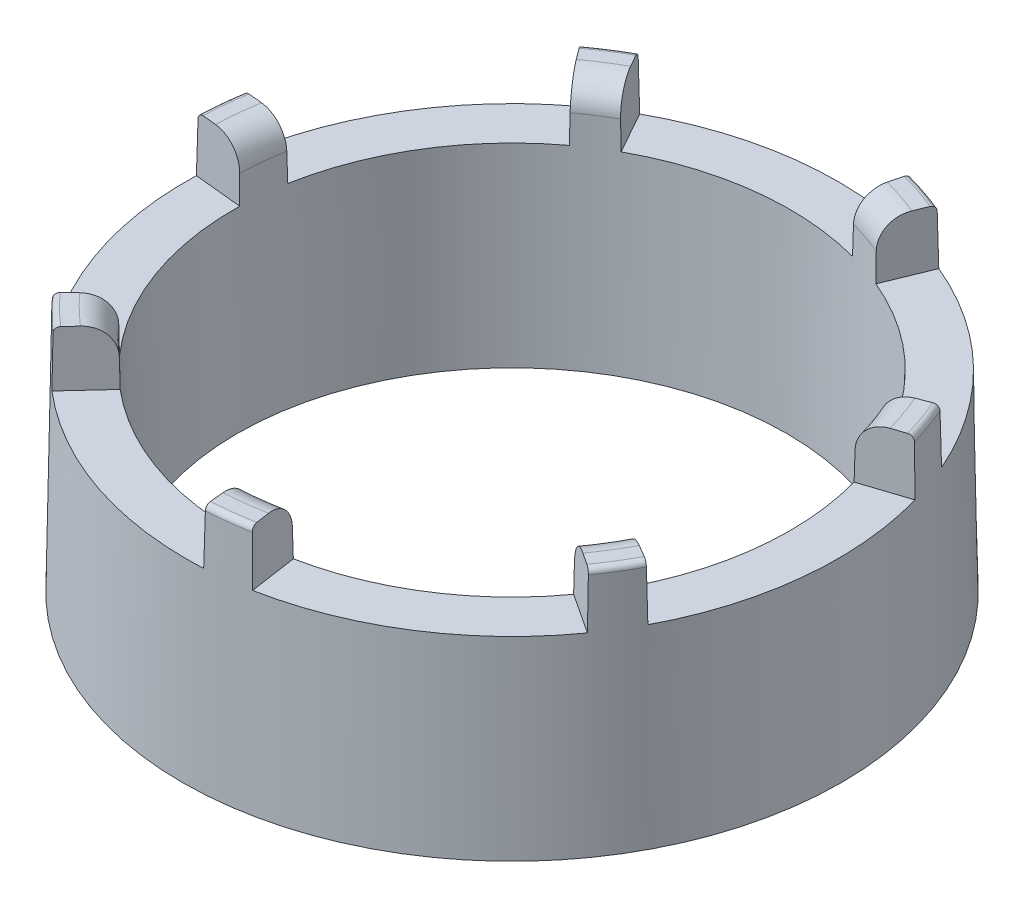
from build123d import *

# Parameters (mm, degrees)
SKETCH8_R                     = 12
SKETCH8_R_2                   = 10
BOSS_EXTRUDE5_DEPTH           = 7
BOSS_EXTRUDE5_DRAFT           = 1
BOSS_EXTRUDE7_DEPTH           = 2
BOSS_EXTRUDE7_DRAFT           = 1
BOSS_EXTRUDE7_PROFILE_2_DEPTH = 2
BOSS_EXTRUDE7_PROFILE_2_DRAFT = 1
BOSS_EXTRUDE7_PROFILE_3_DEPTH = 2
BOSS_EXTRUDE7_PROFILE_3_DRAFT = 1
BOSS_EXTRUDE7_PROFILE_4_DEPTH = 2
BOSS_EXTRUDE7_PROFILE_4_DRAFT = 1
BOSS_EXTRUDE7_PROFILE_5_DEPTH = 2
BOSS_EXTRUDE7_PROFILE_5_DRAFT = 1
BOSS_EXTRUDE7_PROFILE_6_DEPTH = 2
BOSS_EXTRUDE7_PROFILE_6_DRAFT = 1
BOSS_EXTRUDE7_PROFILE_7_DEPTH = 2
BOSS_EXTRUDE7_PROFILE_7_DRAFT = 1
FILLET3_R                     = 0.2
FILLET4_R                     = 1


with BuildPart() as part:
    # Sketch8 → Boss-Extrude5 (with draft: the straight prism first)
    with BuildSketch(Plane(origin=(0, 0, 0), x_dir=(1, 0, 0), z_dir=(0, 1, 0))):
        with Locations((-0.689500998, 0.229833666)):
            Circle(SKETCH8_R)
        with Locations((-0.689500998, 0.229833666)):
            Circle(SKETCH8_R_2, mode=Mode.SUBTRACT)
    extrude(amount=BOSS_EXTRUDE5_DEPTH)
    # Boss-Extrude5: the draft: its side faces are tilted about the plane it starts from
    boss_extrude5_sides = [part.faces().sort_by_distance(p)[0] for p in [
        (-12.689500998, 3.5, -0.229833666),
        (-10.689500998, 3.5, -0.229833666),
    ]]
    draft(boss_extrude5_sides, Plane(origin=(0, 0, 0), x_dir=(1, 0, 0), z_dir=(0, 1, 0)), BOSS_EXTRUDE5_DRAFT)


with BuildPart() as boss_extrude7_tool:
    # Sketch9 → Boss-Extrude7 (with draft: the straight prism first)
    with BuildSketch(Plane(origin=(0, 7, 0), x_dir=(1, 0, 0), z_dir=(0, 1, 0))):
        with BuildLine():
            ThreePointArc((-7.209347937, -7.512919996), (-7.765123044, -7.008550894), (-8.28199938, -6.464388222))
            Line((-8.28199938, -6.464388222), (-9.545268932, -7.685837669))
            ThreePointArc((-9.545268932, -7.685837669), (-8.992344967, -8.264002947), (-8.401756366, -8.803637179))
            Line((-8.401756366, -8.803637179), (-7.209347937, -7.512919996))
        make_face()
    extrude(amount=BOSS_EXTRUDE7_DEPTH)
    # Boss-Extrude7: the draft: its side faces are tilted about the plane it starts from
    boss_extrude7_sides = [boss_extrude7_tool.faces().sort_by_distance(p)[0] for p in [
        (-8.992344967, 8, 8.264002947),
        (-7.805552152, 8, 8.158278588),
        (-7.765123044, 8, 7.008550894),
        (-8.913634156, 8, 7.075112945),
    ]]
    draft(boss_extrude7_sides, Plane(origin=(0, 7, 0), x_dir=(1, 0, 0), z_dir=(0, 1, 0)), BOSS_EXTRUDE7_DRAFT)


with BuildPart() as part_1:
    add(part.part)

    # Boss-Extrude7: add boss_extrude7_tool
    add(boss_extrude7_tool.part)


with BuildPart() as boss_extrude7_profile_2_tool:
    # Sketch9 → Boss-Extrude7 profile 2 (with draft: the straight prism first)
    with BuildSketch(Plane(origin=(0, 7, 0), x_dir=(1, 0, 0), z_dir=(0, 1, 0))):
        with BuildLine():
            ThreePointArc((-10.809530951, 0.438716694), (-10.761410839, 1.237440003), (-10.650350336, 2.029866676))
            Line((-10.650350336, 2.029866676), (-12.401922464, 2.205096122))
            ThreePointArc((-12.401922464, 2.205096122), (-12.508319943, 1.412202953), (-12.56110308, 0.61394614))
            Line((-12.56110308, 0.61394614), (-10.809530951, 0.438716694))
        make_face()
    extrude(amount=BOSS_EXTRUDE7_PROFILE_2_DEPTH)
    # Boss-Extrude7 profile 2: the draft: its side faces are tilted about the plane it starts from
    boss_extrude7_profile_2_sides = [boss_extrude7_profile_2_tool.faces().sort_by_distance(p)[0] for p in [
        (-11.685317015, 8, -0.526331417),
        (-10.761410839, 8, -1.237440003),
        (-11.5261364, 8, -2.117481399),
        (-12.508319943, 8, -1.412202953),
    ]]
    draft(boss_extrude7_profile_2_sides, Plane(origin=(0, 7, 0), x_dir=(1, 0, 0), z_dir=(0, 1, 0)), BOSS_EXTRUDE7_PROFILE_2_DRAFT)


with BuildPart() as part_2:
    add(part_1.part)

    # Boss-Extrude7 profile 2: add boss_extrude7_profile_2_tool
    add(boss_extrude7_profile_2_tool.part)


with BuildPart() as boss_extrude7_profile_3_tool:
    # Sketch9 → Boss-Extrude7 profile 3 (with draft: the straight prism first)
    with BuildSketch(Plane(origin=(0, 7, 0), x_dir=(1, 0, 0), z_dir=(0, 1, 0))):
        with BuildLine():
            ThreePointArc((-6.727066623, 8.354268397), (-6.166482087, 8.742254974), (-5.581052028, 9.091626199))
            Line((-5.581052028, 9.091626199), (-6.436662035, 10.624669806))
            ThreePointArc((-6.436662035, 10.624669806), (-7.123347108, 10.214226618), (-7.78084598, 9.758490692))
            Line((-7.78084598, 9.758490692), (-6.727066623, 8.354268397))
        make_face()
    extrude(amount=BOSS_EXTRUDE7_PROFILE_3_DEPTH)
    # Boss-Extrude7 profile 3: the draft: its side faces are tilted about the plane it starts from
    boss_extrude7_profile_3_sides = [boss_extrude7_profile_3_tool.faces().sort_by_distance(p)[0] for p in [
        (-7.253956301, 8, -9.056379545),
        (-6.166482087, 8, -8.742254974),
        (-6.008857032, 8, -9.858148003),
        (-7.123347108, 8, -10.214226618),
    ]]
    draft(boss_extrude7_profile_3_sides, Plane(origin=(0, 7, 0), x_dir=(1, 0, 0), z_dir=(0, 1, 0)), BOSS_EXTRUDE7_PROFILE_3_DRAFT)


with BuildPart() as part_3:
    add(part_2.part)

    # Boss-Extrude7 profile 3: add boss_extrude7_profile_3_tool
    add(boss_extrude7_profile_3_tool.part)


with BuildPart() as boss_extrude7_profile_4_tool:
    # Sketch9 → Boss-Extrude7 profile 4 (with draft: the straight prism first)
    with BuildSketch(Plane(origin=(0, 7, 0), x_dir=(1, 0, 0), z_dir=(0, 1, 0))):
        with BuildLine():
            Line((2.366640727, 11.7077462), (1.926100917, 10.008241767))
            ThreePointArc((1.926100917, 10.008241767), (2.578394525, 9.809995315), (3.215863804, 9.568289863))
            Line((3.215863804, 9.568289863), (3.880694044, 11.193217982))
            ThreePointArc((3.880694044, 11.193217982), (3.132335987, 11.475990362), (2.366640727, 11.7077462))
        make_face()
    extrude(amount=BOSS_EXTRUDE7_PROFILE_4_DEPTH)
    # Boss-Extrude7 profile 4: the draft: its side faces are tilted about the plane it starts from
    boss_extrude7_profile_4_sides = [boss_extrude7_profile_4_tool.faces().sort_by_distance(p)[0] for p in [
        (3.132335987, 8, -11.475990362),
        (2.146370822, 8, -10.857993984),
        (2.578394525, 8, -9.809995315),
        (3.548278924, 8, -10.380753922),
    ]]
    draft(boss_extrude7_profile_4_sides, Plane(origin=(0, 7, 0), x_dir=(1, 0, 0), z_dir=(0, 1, 0)), BOSS_EXTRUDE7_PROFILE_4_DRAFT)


with BuildPart() as part_4:
    add(part_3.part)

    # Boss-Extrude7 profile 4: add boss_extrude7_profile_4_tool
    add(boss_extrude7_profile_4_tool.part)


with BuildPart() as boss_extrude7_profile_5_tool:
    # Sketch9 → Boss-Extrude7 profile 5 (with draft: the straight prism first)
    with BuildSketch(Plane(origin=(0, 7, 0), x_dir=(1, 0, 0), z_dir=(0, 1, 0))):
        with BuildLine():
            Line((10.198955387, 4.975778875), (8.561854638, 4.337272925))
            ThreePointArc((8.561854638, 4.337272925), (8.840763983, 3.640506293), (9.06727997, 2.92498923))
            Line((9.06727997, 2.92498923), (10.737769949, 3.470197392))
            ThreePointArc((10.737769949, 3.470197392), (10.493728209, 4.232065904), (10.198955387, 4.975778875))
        make_face()
    extrude(amount=BOSS_EXTRUDE7_PROFILE_5_DEPTH)
    # Boss-Extrude7 profile 5: the draft: its side faces are tilted about the plane it starts from
    boss_extrude7_profile_5_sides = [boss_extrude7_profile_5_tool.faces().sort_by_distance(p)[0] for p in [
        (10.493728209, 8, -4.232065904),
        (9.380405013, 8, -4.6565259),
        (8.840763983, 8, -3.640506293),
        (9.90252496, 8, -3.197593311),
    ]]
    draft(boss_extrude7_profile_5_sides, Plane(origin=(0, 7, 0), x_dir=(1, 0, 0), z_dir=(0, 1, 0)), BOSS_EXTRUDE7_PROFILE_5_DRAFT)


with BuildPart() as part_5:
    add(part_4.part)

    # Boss-Extrude7 profile 5: add boss_extrude7_profile_5_tool
    add(boss_extrude7_profile_5_tool.part)


with BuildPart() as boss_extrude7_profile_6_tool:
    # Sketch9 → Boss-Extrude7 profile 6 (with draft: the straight prism first)
    with BuildSketch(Plane(origin=(0, 7, 0), x_dir=(1, 0, 0), z_dir=(0, 1, 0))):
        with BuildLine():
            Line((9.809829479, -5.324132297), (8.289916221, -4.44228628))
            ThreePointArc((8.289916221, -4.44228628), (7.919054516, -5.094770576), (7.500866623, -5.717982455))
            Line((7.500866623, -5.717982455), (8.968653964, -6.684103064))
            ThreePointArc((8.968653964, -6.684103064), (9.412154061, -6.018289528), (9.809829479, -5.324132297))
        make_face()
    extrude(amount=BOSS_EXTRUDE7_PROFILE_6_DEPTH)
    # Boss-Extrude7 profile 6: the draft: its side faces are tilted about the plane it starts from
    boss_extrude7_profile_6_sides = [boss_extrude7_profile_6_tool.faces().sort_by_distance(p)[0] for p in [
        (9.04987285, 8, 4.883209289),
        (7.919054516, 8, 5.094770576),
        (8.234760293, 8, 6.20104276),
        (9.412154061, 8, 6.018289528),
    ]]
    draft(boss_extrude7_profile_6_sides, Plane(origin=(0, 7, 0), x_dir=(1, 0, 0), z_dir=(0, 1, 0)), BOSS_EXTRUDE7_PROFILE_6_DRAFT)


with BuildPart() as part_6:
    add(part_5.part)

    # Boss-Extrude7 profile 6: add boss_extrude7_profile_6_tool
    add(boss_extrude7_profile_6_tool.part)


with BuildPart() as boss_extrude7_profile_7_tool:
    # Sketch9 → Boss-Extrude7 profile 7 (with draft: the straight prism first)
    with BuildSketch(Plane(origin=(0, 7, 0), x_dir=(1, 0, 0), z_dir=(0, 1, 0))):
        with BuildLine():
            ThreePointArc((1.280752997, -9.698748185), (0.534166556, -9.818115184), (-0.219247003, -9.881422416))
            Line((-0.219247003, -9.881422416), (-0.050535252, -11.630781881))
            ThreePointArc((-0.050535252, -11.630781881), (0.746403959, -11.560868405), (1.536829397, -11.437468136))
            Line((1.536829397, -11.437468136), (1.280752997, -9.698748185))
        make_face()
    extrude(amount=BOSS_EXTRUDE7_PROFILE_7_DEPTH)
    # Boss-Extrude7 profile 7: the draft: its side faces are tilted about the plane it starts from
    boss_extrude7_profile_7_sides = [boss_extrude7_profile_7_tool.faces().sort_by_distance(p)[0] for p in [
        (1.408791197, 8, 10.568108161),
        (0.534166556, 8, 9.818115184),
        (-0.134891127, 8, 10.756102148),
        (0.746403959, 8, 11.560868405),
    ]]
    draft(boss_extrude7_profile_7_sides, Plane(origin=(0, 7, 0), x_dir=(1, 0, 0), z_dir=(0, 1, 0)), BOSS_EXTRUDE7_PROFILE_7_DRAFT)


with BuildPart() as part_7:
    add(part_6.part)

    # Boss-Extrude7 profile 7: add boss_extrude7_profile_7_tool
    add(boss_extrude7_profile_7_tool.part)

    # Fillet3
    fillet3_edges = [part_7.edges().sort_by_distance(p)[0] for p in [
        (-8.967942047, 9, 8.239038679),
        (0.742183685, 9, 11.526214308),
        (9.382464248, 9, 5.999925646),
        (10.460859537, 9, -4.220302928),
        (3.121321399, 9, -11.44286259),
        (-7.104320002, 9, -10.184957078),
        (-12.473583207, 9, -1.408727847),
    ]]
    fillet(fillet3_edges, radius=FILLET3_R)

    # Fillet4
    fillet4_edges = [part_7.edges().sort_by_distance(p)[0] for p in [
        (-6.18550884, 9, -8.771524863),
        (-10.796147575, 9, -1.240915109),
        (-7.789525964, 9, 7.033515162),
        (0.538386829, 9, 9.852769281),
        (7.948744329, 9, 5.113134459),
        (8.873632654, 9, -3.652269269),
        (2.589409961, 9, -9.843123094),
    ]]
    fillet(fillet4_edges, radius=FILLET4_R)


solid = part_7.part
